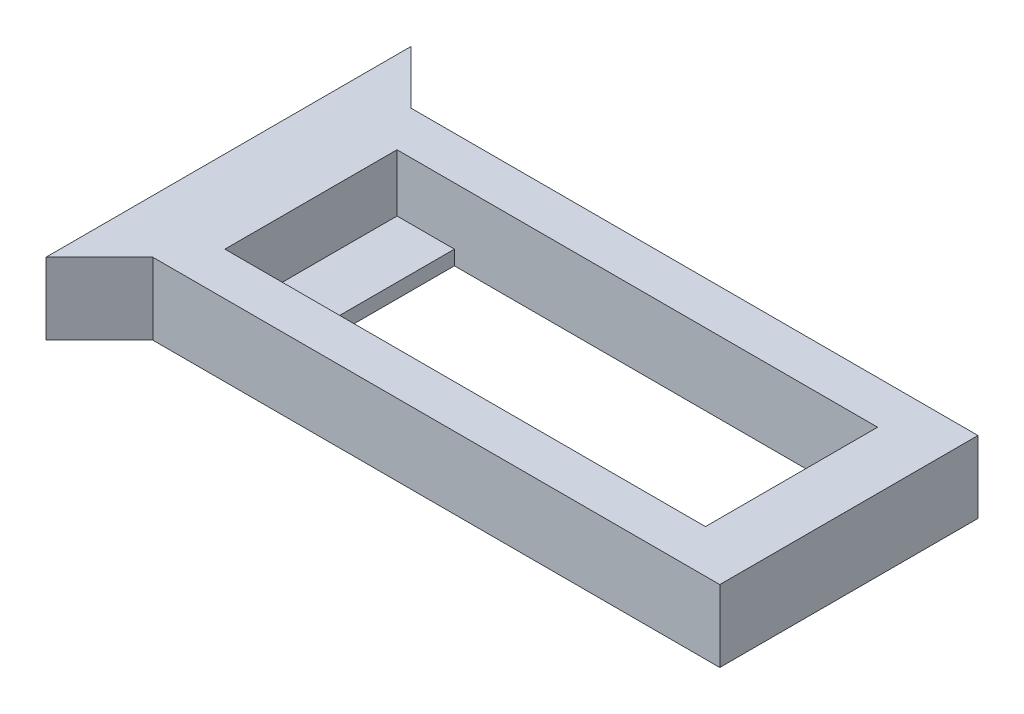
from build123d import *

# Parameters (mm, degrees)
SKETCH1_W           = 43.25
SKETCH1_H           = 5.00807777
BOSS_EXTRUDE1_DEPTH = 18
SKETCH2_W           = 33.5
SKETCH2_H           = 12
CUT_EXTRUDE1_DEPTH  = 4
CUT_EXTRUDE2_REACH  = 30.419
SKETCH3_W           = 25.5
SKETCH3_H           = 12
CUT_EXTRUDE3_REACH  = 30.419
SKETCH4_W           = 5
SKETCH4_H           = 5
BOSS_EXTRUDE2_DEPTH = 5.00807777


with BuildPart() as part:
    # Sketch1 → Boss-Extrude1 (new body)
    with BuildSketch(Plane.XY):
        with Locations((0, -2.504038885)):
            Rectangle(SKETCH1_W, SKETCH1_H)
    extrude(amount=BOSS_EXTRUDE1_DEPTH)

    # Sketch2 → Cut-Extrude1 (cut)
    with BuildSketch(Plane(origin=(0, 0, 0), x_dir=(1, 0, 0), z_dir=(0, 1, 0))):
        with Locations((0.875, -9)):
            Rectangle(SKETCH2_W, SKETCH2_H)
    extrude(amount=-CUT_EXTRUDE1_DEPTH, mode=Mode.SUBTRACT)

    # Sketch3 → Cut-Extrude2 (cut, up to next)
    with BuildSketch(Plane(origin=(0, -4, 0), x_dir=(1, 0, 0), z_dir=(0, 1, 0)), mode=Mode.PRIVATE) as cut_extrude2_sk1:
        with Locations((0.875, -9)):
            Rectangle(SKETCH3_W, SKETCH3_H)
    cut_extrude2_tool1 = extrude(cut_extrude2_sk1.sketch, amount=-CUT_EXTRUDE2_REACH, mode=Mode.PRIVATE) & part.part
    add(cut_extrude2_tool1.solids().sort_by_distance((0.875, -4, 9))[0], mode=Mode.SUBTRACT)

    # Sketch4 → Cut-Extrude3 (cut, up to next)
    with BuildSketch(Plane(origin=(0, -4, 0), x_dir=(1, 0, 0), z_dir=(0, 1, 0)), mode=Mode.PRIVATE) as cut_extrude3_sk1:
        with Locations((16.125, -9)):
            Rectangle(SKETCH4_W, SKETCH4_H)
    cut_extrude3_tool1 = extrude(cut_extrude3_sk1.sketch, amount=-CUT_EXTRUDE3_REACH, mode=Mode.PRIVATE) & part.part
    add(cut_extrude3_tool1.solids().sort_by_distance((16.125, -4, 9))[0], mode=Mode.SUBTRACT)

    # Sketch5 → Boss-Extrude2 (add)
    with BuildSketch(Plane(origin=(0, 0, 0), x_dir=(1, 0, 0), z_dir=(0, 1, 0))):
        Polygon((-21.625, 0), (-21.625, 3.721580372), (-17.903419628, 0), align=None)
        Polygon((-17.903419628, -18), (-21.625, -18), (-21.625, -21.721580372), align=None)
    extrude(amount=-BOSS_EXTRUDE2_DEPTH)


solid = part.part
